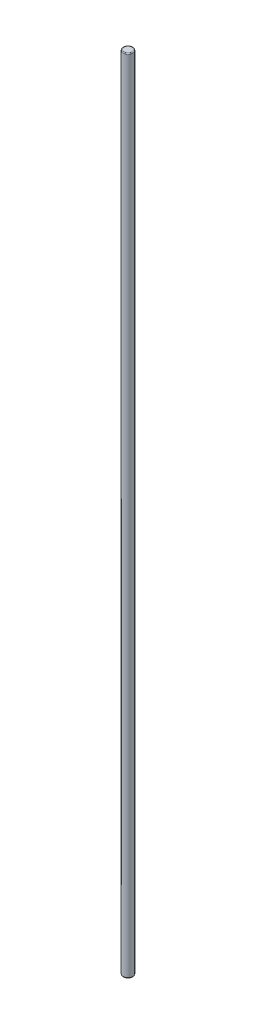
from build123d import *

# Parameters (mm, degrees)
SKETCH1_R           = 6
BOSS_EXTRUDE1_DEPTH = 1000
FILLET1_R           = 1


with BuildPart() as part:
    # Sketch1 → Boss-Extrude1 (new body)
    with BuildSketch(Plane(origin=(0, 0, 0), x_dir=(1, 0, 0), z_dir=(0, 1, 0))):
        with Locations(Location((0, 0, 0), (0, 0, 270))):
            Circle(SKETCH1_R)
    extrude(amount=BOSS_EXTRUDE1_DEPTH)

    # Fillet1
    fillet1_edges = [part.edges().sort_by_distance(p)[0] for p in [
        (0, 0, -6),
        (0, 1000, -6),
    ]]
    fillet(fillet1_edges, radius=FILLET1_R)


solid = part.part
